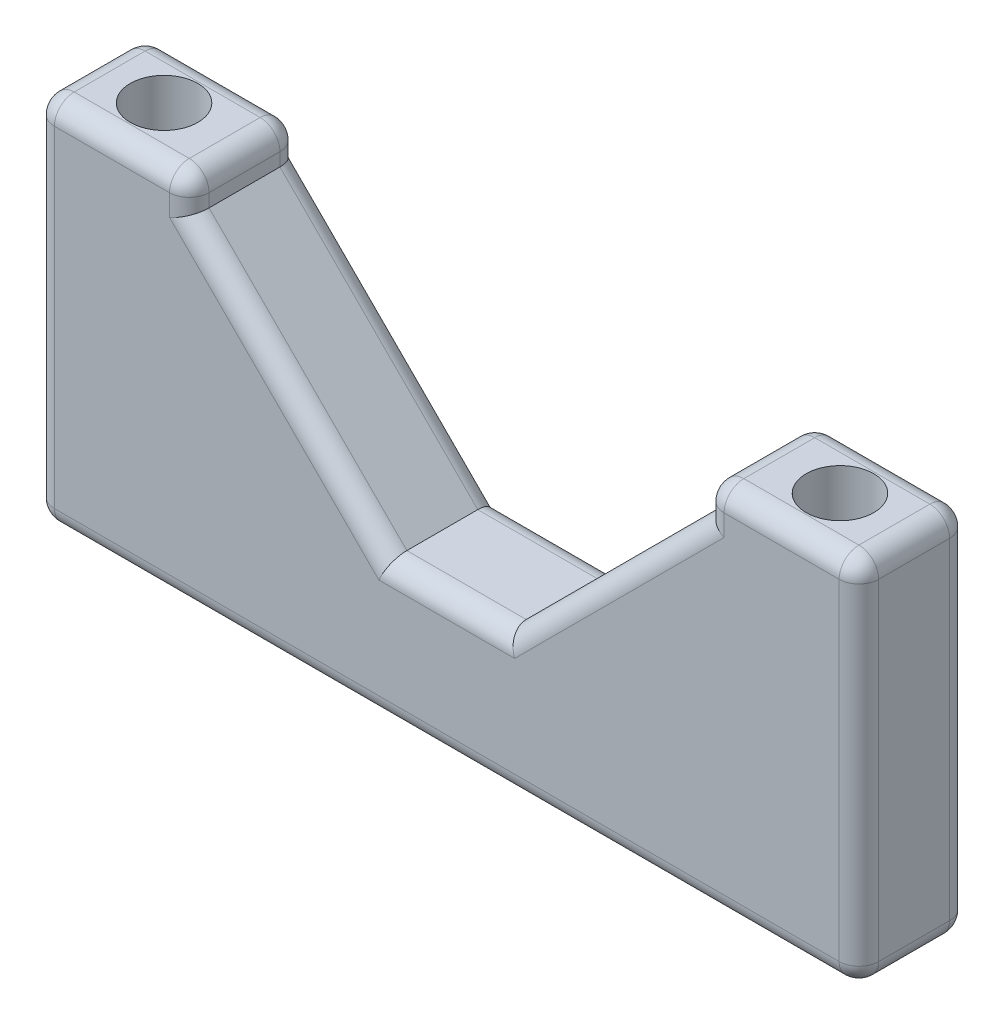
from build123d import *

# Parameters (mm, degrees)
SKETCH1_W              = 25
SKETCH1_H              = 3.35
SKETCH1_R              = 1.025
STANDOFF_EXTRUDE_DEPTH = 11.24
SKETCH2_W              = 15.62
SKETCH2_H              = 7
STANDOFF_CUT_DEPTH     = 18.140889709
CHAMFER1_SIZE          = 6
FILLET2_R              = 0.6


with BuildPart() as part:
    # Sketch1 → Standoff Extrude (new body)
    with BuildSketch(Plane(origin=(0, 0, 0), x_dir=(1, 0, 0), z_dir=(0, 1, 0))):
        Rectangle(SKETCH1_W, SKETCH1_H)
        with Locations(Location((-10.25, 0, 0), (0, 0, 270))):
            Circle(SKETCH1_R, mode=Mode.SUBTRACT)
        with Locations(Location((10.25, 0, 0), (0, 0, 270))):
            Circle(SKETCH1_R, mode=Mode.SUBTRACT)
    extrude(amount=STANDOFF_EXTRUDE_DEPTH)

    # Sketch2 → Standoff Cut (cut, through all)
    with BuildSketch(Plane.XY.offset(1.675)):
        with Locations((0, 7.74)):
            Rectangle(SKETCH2_W, SKETCH2_H)
    extrude(amount=-STANDOFF_CUT_DEPTH, mode=Mode.SUBTRACT)

    # Chamfer1
    chamfer1_edges = [part.edges().sort_by_distance(p)[0] for p in [
        (-7.81, 4.24, 0),
        (7.81, 4.24, 0),
    ]]
    chamfer(chamfer1_edges, length=CHAMFER1_SIZE)

    # Fillet2
    fillet2_edges = [part.edges().sort_by_distance(p)[0] for p in [
        (12.5, 11.24, 0),
        (10.155, 11.24, -1.675),
        (-10.155, 11.24, -1.675),
        (10.155, 11.24, 1.675),
        (-7.81, 10.74, -1.675),
        (-7.81, 11.24, 0),
        (7.81, 11.24, 0),
        (-7.81, 10.74, 1.675),
        (7.81, 10.74, 1.675),
        (7.81, 10.74, -1.675),
        (0, 4.24, 1.675),
        (0, 4.24, -1.675),
        (-12.5, 11.24, 0),
        (4.81, 7.24, 1.675),
        (4.81, 7.24, -1.675),
        (-4.81, 7.24, 1.675),
        (-4.81, 7.24, -1.675),
        (0, 0, -1.675),
        (12.5, 0, 0),
        (0, 0, 1.675),
        (-12.5, 0, 0),
        (-10.155, 11.24, 1.675),
        (-12.5, 5.62, -1.675),
        (12.5, 5.62, -1.675),
        (12.5, 5.62, 1.675),
        (-12.5, 5.62, 1.675),
    ]]
    fillet(fillet2_edges, radius=FILLET2_R)


solid = part.part
